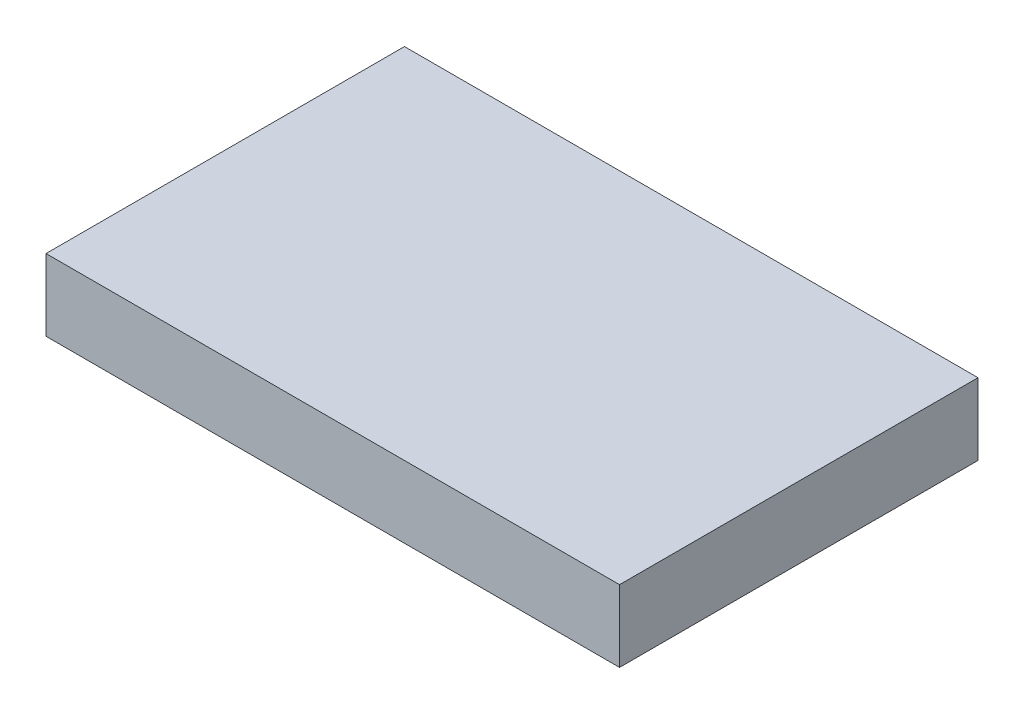
from build123d import *

# Parameters (mm, degrees)
SKETCH_1_W      = 40
SKETCH_1_H      = 25
EXTRUDE_1_DEPTH = 5


with BuildPart() as part:
    # 草图1 → 凸台-拉伸1 (new body)
    with BuildSketch(Plane(origin=(0, 0, 0), x_dir=(1, 0, 0), z_dir=(0, 1, 0))):
        with Locations((-13.13253012, 6.204819277)):
            Rectangle(SKETCH_1_W, SKETCH_1_H)
    extrude(amount=EXTRUDE_1_DEPTH)


solid = part.part
